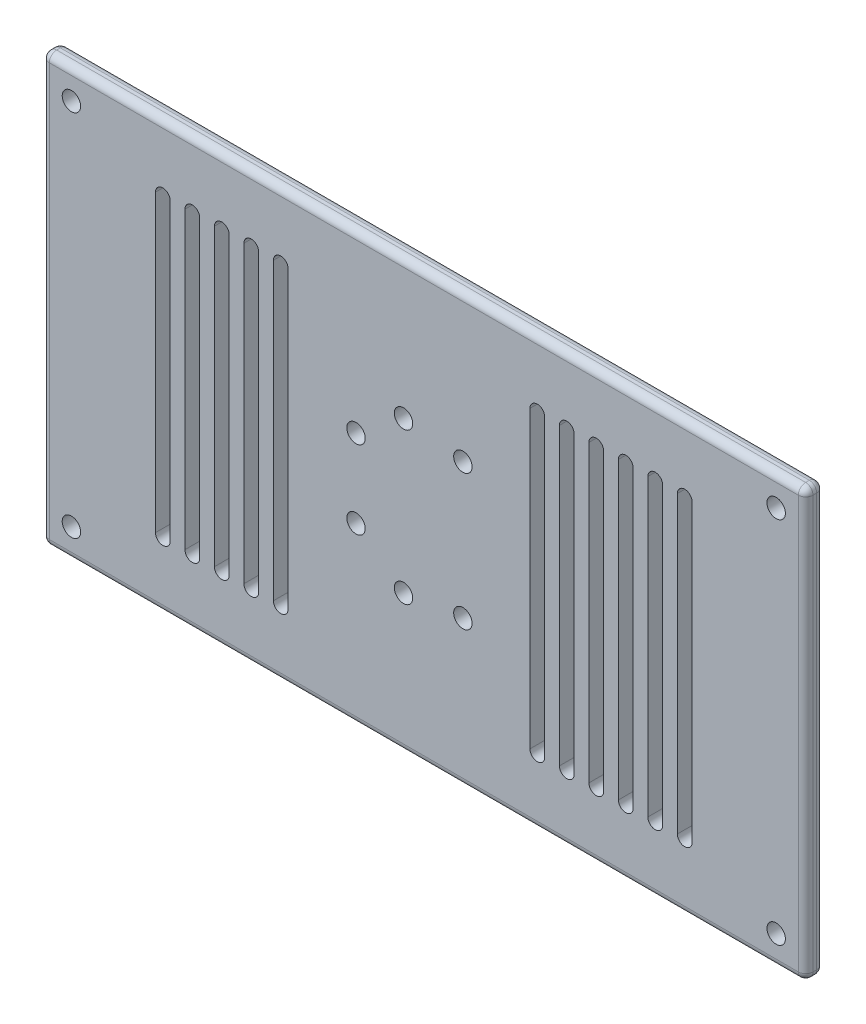
from build123d import *

# Parameters (mm, degrees)
ESQUISSE1_W                                   = 103.6
ESQUISSE1_H                                   = 58
BOSS_EXTRU_1_DEPTH                            = 2.5
CONG_3_R                                      = 1
ESQUISSE32_R                                  = 3
BOSS_EXTRU_8_DEPTH                            = 7
ESQUISSE26_R                                  = 3
BOSS_EXTRU_10_DEPTH                           = 7
ESQUISSE17_R                                  = 3
BOSS_EXTRU_7_DEPTH                            = 7
TROU_POUR_TARAUDAGE_POUR_TROU_TARAUD_M3_D     = 2.5
TROU_POUR_TARAUDAGE_POUR_TROU_TARAUD_M3_DEPTH = 5
TROU_POUR_TARAUDAGE_POUR_TROU_TARAUD_M3_TIP   = 0.751075774
TROU_POUR_TARAUDAGE_POUR_TROU_TARAUD_2_D      = 2.5
TROU_POUR_TARAUDAGE_POUR_TROU_TARAUD_2_DEPTH  = 5
TROU_POUR_TARAUDAGE_POUR_TROU_TARAUD_2_TIP    = 0.751075774
TROU_POUR_TARAUDAGE_POUR_TROU_TARAUD_3_D      = 2.5
TROU_POUR_TARAUDAGE_POUR_TROU_TARAUD_3_DEPTH  = 5
TROU_POUR_TARAUDAGE_POUR_TROU_TARAUD_3_TIP    = 0.751075774
CONG_5_R                                      = 0.5
TROU_POUR_TARAUDAGE_POUR_TROU_TARAUD_4_D      = 2.5
TROU_POUR_TARAUDAGE_POUR_TROU_TARAUD_4_DEPTH  = 5
TROU_POUR_TARAUDAGE_POUR_TROU_TARAUD_4_TIP    = 0.751075774
ENL_V_MAT_EXTRU_2_DEPTH                       = 60.776584044
R_P_TITION_LIN_AIRE1_COUNT                    = 6
R_P_TITION_LIN_AIRE1_PITCH                    = 4
ENL_V_MAT_EXTRU_3_DEPTH                       = 60.776584044
R_P_TITION_LIN_AIRE2_COUNT                    = 5
R_P_TITION_LIN_AIRE2_PITCH                    = 4


with BuildPart() as part:
    # Esquisse1 → Boss.-Extru.1 (new body)
    with BuildSketch(Plane.XY):
        Rectangle(ESQUISSE1_W, ESQUISSE1_H)
    extrude(amount=BOSS_EXTRU_1_DEPTH)

    # Congé3
    cong_3_edges = [part.edges().sort_by_distance(p)[0] for p in [
        (-51.8, 0, 2.5),
        (0, -29, 2.5),
        (51.8, 0, 2.5),
        (0, -29, 0),
        (-51.8, 0, 0),
        (0, 29, 0),
        (51.8, 0, 0),
        (51.8, -29, 1.25),
        (-51.8, -29, 1.25),
        (-51.8, 29, 1.25),
        (51.8, 29, 1.25),
        (0, 29, 2.5),
    ]]
    fillet(cong_3_edges, radius=CONG_3_R)

    # Esquisse32 → Boss.-Extru.8 (add)
    with BuildSketch(Plane.XY.offset(2.5)):
        with Locations((5.303300859, 9.192388155)):
            Circle(ESQUISSE32_R)
        with Locations((-9.192388155, -5.303300859)):
            Circle(ESQUISSE32_R)
    extrude(amount=-BOSS_EXTRU_8_DEPTH)

    # Esquisse26 → Boss.-Extru.10 (add)
    with BuildSketch(Plane.XY.offset(2.5)):
        with Locations((-9.192388155, 5.303300859)):
            Circle(ESQUISSE26_R)
        with Locations((5.303300859, -9.192388155)):
            Circle(ESQUISSE26_R)
    extrude(amount=-BOSS_EXTRU_10_DEPTH)

    # Esquisse17 → Boss.-Extru.7 (add)
    with BuildSketch(Plane.XY.offset(2.5)):
        with Locations((-2.75, 10.25)):
            Circle(ESQUISSE17_R)
        with Locations((-2.75, -10.25)):
            Circle(ESQUISSE17_R)
    extrude(amount=-BOSS_EXTRU_7_DEPTH)

    # Trou pour taraudage pour trou taraud_ M3
    with Locations(Plane(origin=(-2.75, -10.25, 2.5), x_dir=(1, 0, 0), z_dir=(0, 0, 1))):
        with Locations((0, 0), (0, 20.5)):
            Hole(TROU_POUR_TARAUDAGE_POUR_TROU_TARAUD_M3_D / 2, depth=TROU_POUR_TARAUDAGE_POUR_TROU_TARAUD_M3_DEPTH)
            with Locations((0, 0, -(TROU_POUR_TARAUDAGE_POUR_TROU_TARAUD_M3_DEPTH + TROU_POUR_TARAUDAGE_POUR_TROU_TARAUD_M3_TIP / 2))):  # 118° drill point
                Cone(0, TROU_POUR_TARAUDAGE_POUR_TROU_TARAUD_M3_D / 2, TROU_POUR_TARAUDAGE_POUR_TROU_TARAUD_M3_TIP, mode=Mode.SUBTRACT)

    # Trou pour taraudage pour trou taraud 2
    with Locations(Plane(origin=(-9.192388155, 5.303300859, 2.5), x_dir=(1, 0, 0), z_dir=(0, 0, 1))):
        with Locations((0, 0), (14.495689014, -14.495689014)):
            Hole(TROU_POUR_TARAUDAGE_POUR_TROU_TARAUD_2_D / 2, depth=TROU_POUR_TARAUDAGE_POUR_TROU_TARAUD_2_DEPTH)
            with Locations((0, 0, -(TROU_POUR_TARAUDAGE_POUR_TROU_TARAUD_2_DEPTH + TROU_POUR_TARAUDAGE_POUR_TROU_TARAUD_2_TIP / 2))):  # 118° drill point
                Cone(0, TROU_POUR_TARAUDAGE_POUR_TROU_TARAUD_2_D / 2, TROU_POUR_TARAUDAGE_POUR_TROU_TARAUD_2_TIP, mode=Mode.SUBTRACT)

    # Trou pour taraudage pour trou taraud 3
    with Locations(Plane(origin=(5.303300859, 9.192388155, 2.5), x_dir=(1, 0, 0), z_dir=(0, 0, 1))):
        with Locations((0, 0), (-14.495689014, -14.495689014)):
            Hole(TROU_POUR_TARAUDAGE_POUR_TROU_TARAUD_3_D / 2, depth=TROU_POUR_TARAUDAGE_POUR_TROU_TARAUD_3_DEPTH)
            with Locations((0, 0, -(TROU_POUR_TARAUDAGE_POUR_TROU_TARAUD_3_DEPTH + TROU_POUR_TARAUDAGE_POUR_TROU_TARAUD_3_TIP / 2))):  # 118° drill point
                Cone(0, TROU_POUR_TARAUDAGE_POUR_TROU_TARAUD_3_D / 2, TROU_POUR_TARAUDAGE_POUR_TROU_TARAUD_3_TIP, mode=Mode.SUBTRACT)

    # Congé5
    cong_5_edges = [part.edges().sort_by_distance(p)[0] for p in [
        (-12.192388155, -5.303300859, -4.5),
        (-12.192388155, -5.303300859, 0),
        (2.303300859, 9.192388155, -4.5),
        (2.303300859, 9.192388155, 0),
        (2.303300859, -9.192388155, -4.5),
        (2.303300859, -9.192388155, 0),
        (-12.192388155, 5.303300859, -4.5),
        (-12.192388155, 5.303300859, 0),
        (-5.75, 10.25, -4.5),
        (-5.75, 10.25, 0),
        (-5.75, -10.25, -4.5),
        (-5.75, -10.25, 0),
    ]]
    fillet(cong_5_edges, radius=CONG_5_R)

    # Trou pour taraudage pour trou taraud 4
    with Locations(Plane(origin=(47.8, 25, 2.5), x_dir=(1, 0, 0), z_dir=(0, 0, 1))):
        with Locations((0, 0), (0, -50), (-95.6, -50), (-95.6, 0)):
            Hole(TROU_POUR_TARAUDAGE_POUR_TROU_TARAUD_4_D / 2, depth=TROU_POUR_TARAUDAGE_POUR_TROU_TARAUD_4_DEPTH)
            with Locations((0, 0, -(TROU_POUR_TARAUDAGE_POUR_TROU_TARAUD_4_DEPTH + TROU_POUR_TARAUDAGE_POUR_TROU_TARAUD_4_TIP / 2))):  # 118° drill point
                Cone(0, TROU_POUR_TARAUDAGE_POUR_TROU_TARAUD_4_D / 2, TROU_POUR_TARAUDAGE_POUR_TROU_TARAUD_4_TIP, mode=Mode.SUBTRACT)

    # Esquisse36 → Enlèv. mat.-Extru.2 (cut, through all)
    with BuildSketch(Plane.XY.offset(2.5)):
        with BuildLine():
            Line((36.4, 20), (36.4, -20))
            ThreePointArc((36.4, -20), (35.4, -21), (34.4, -20))
            Line((34.4, -20), (34.4, 20))
            ThreePointArc((34.4, 20), (35.4, 21), (36.4, 20))
        make_face()
    enl_v_mat_extru_2 = extrude(amount=-ENL_V_MAT_EXTRU_2_DEPTH, mode=Mode.SUBTRACT)

    # Répétition linéaire1: Enlèv. mat.-Extru.2 ×6
    with Locations(*[(-i * R_P_TITION_LIN_AIRE1_PITCH, 0, 0) for i in range(1, R_P_TITION_LIN_AIRE1_COUNT)]):
        add(enl_v_mat_extru_2, mode=Mode.SUBTRACT)

    # Esquisse37 → Enlèv. mat.-Extru.3 (cut, through all)
    with BuildSketch(Plane.XY.offset(2.5)):
        with BuildLine():
            Line((-34.4, 20), (-34.4, -20))
            ThreePointArc((-34.4, -20), (-35.4, -21), (-36.4, -20))
            Line((-36.4, -20), (-36.4, 20))
            ThreePointArc((-36.4, 20), (-35.4, 21), (-34.4, 20))
        make_face()
    enl_v_mat_extru_3 = extrude(amount=-ENL_V_MAT_EXTRU_3_DEPTH, mode=Mode.SUBTRACT)

    # Répétition linéaire2: Enlèv. mat.-Extru.3 ×5
    with Locations(*[(i * R_P_TITION_LIN_AIRE2_PITCH, 0, 0) for i in range(1, R_P_TITION_LIN_AIRE2_COUNT)]):
        add(enl_v_mat_extru_3, mode=Mode.SUBTRACT)


solid = part.part
